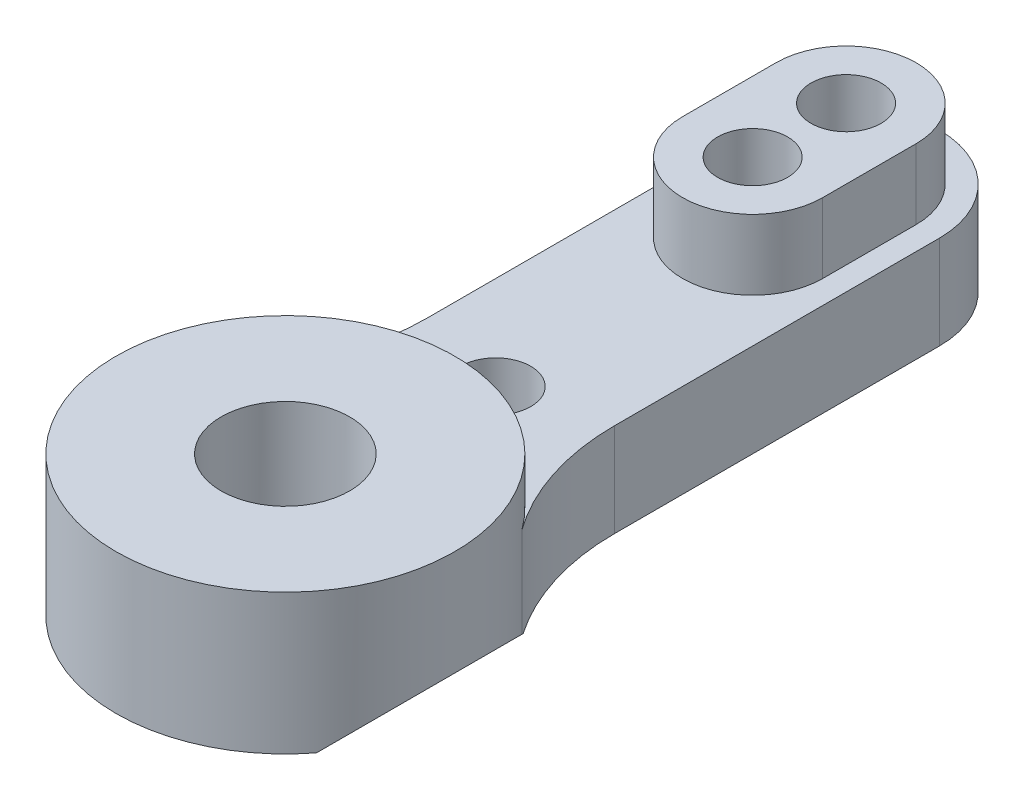
from build123d import *

# Parameters (mm, degrees)
BOSS_EXTRUDE1_DEPTH = 2
BOSS_EXTRUDE2_START = 2
SKETCH2_R           = 7.25
BOSS_EXTRUDE2_DEPTH = 2
BOSS_EXTRUDE3_DEPTH = 3
SKETCH4_R           = 2.75
CUT_EXTRUDE1_DEPTH  = 22.427202337
SKETCH5_R           = 4
CUT_EXTRUDE2_DEPTH  = 1
SKETCH6_R           = 1.5
CUT_EXTRUDE3_DEPTH  = 22.728437588
FILLET1_R           = 10
CUT_EXTRUDE4_DEPTH  = 18


with BuildPart() as part:
    # Sketch1 → Boss-Extrude1 (new, symmetric)
    with BuildSketch(Plane(origin=(0, 0, 0), x_dir=(1, 0, 0), z_dir=(0, 1, 0))):
        with BuildLine():
            Line((-4, -5.953306689), (-4, 12))
            ThreePointArc((-4, 12), (0, 16), (4, 12))
            Line((4, 12), (4, -5.953306689))
            ThreePointArc((4, -5.953306689), (0, -19.25), (-4, -5.953306689))
        make_face()
    extrude(amount=BOSS_EXTRUDE1_DEPTH, both=True)

    # Sketch2 → Boss-Extrude2 (add)
    with BuildSketch(Plane(origin=(0, 2, 0), x_dir=(1, 0, 0), z_dir=(0, 1, 0)).offset(BOSS_EXTRUDE2_START)):
        with Locations(Location((0, -12, 0), (0, 0, 56.514623377))):
            Circle(SKETCH2_R)
    extrude(amount=-BOSS_EXTRUDE2_DEPTH)

    # Sketch3 → Boss-Extrude3 (add)
    with BuildSketch(Plane(origin=(0, 2, 0), x_dir=(1, 0, 0), z_dir=(0, 1, 0))):
        with BuildLine():
            Line((-3, 12), (-3, 8))
            ThreePointArc((-3, 8), (0, 5), (3, 8))
            Line((3, 8), (3, 12))
            ThreePointArc((3, 12), (0, 15), (-3, 12))
        make_face()
    extrude(amount=BOSS_EXTRUDE3_DEPTH)

    # Sketch4 → Cut-Extrude1 (cut, through all)
    with BuildSketch(Plane(origin=(0, 4, 0), x_dir=(1, 0, 0), z_dir=(0, 1, 0))):
        with Locations(Location((0, -12, 0), (0, 0, 270))):
            Circle(SKETCH4_R)
    extrude(amount=-CUT_EXTRUDE1_DEPTH, mode=Mode.SUBTRACT)

    # Sketch5 → Cut-Extrude2 (cut)
    with BuildSketch(Plane.XZ.offset(2)):
        with Locations(Location((0, 12, 0), (0, 0, 270))):
            Circle(SKETCH5_R)
    extrude(amount=-CUT_EXTRUDE2_DEPTH, mode=Mode.SUBTRACT)

    # Sketch6 → Cut-Extrude3 (cut, through all)
    with BuildSketch(Plane.XZ.offset(2)):
        with Locations(Location((0, -12, 0), (0, 0, 270))):
            Circle(SKETCH6_R)
        with Locations(Location((0, -8, 0), (0, 0, 270))):
            Circle(SKETCH6_R)
        with Locations(Location((0, 3, 0), (0, 0, 270))):
            Circle(SKETCH6_R)
    extrude(amount=-CUT_EXTRUDE3_DEPTH, mode=Mode.SUBTRACT)

    # Fillet1
    fillet1_edges = [part.edges().sort_by_distance(p)[0] for p in [
        (-4, 0, 5.953306689),
        (4, 0, 5.953306689),
    ]]
    fillet(fillet1_edges, radius=FILLET1_R)

    # Sketch7 → Cut-Extrude4 (cut)
    with BuildSketch(Plane.XY):
        Polygon((-7.25, -2), (-5.75, -2), (-7.25, -0.5), align=None)
        Polygon((7.25, -2), (5.75, -2), (7.25, -0.5), align=None)
    extrude(amount=CUT_EXTRUDE4_DEPTH, mode=Mode.SUBTRACT)


solid = part.part
